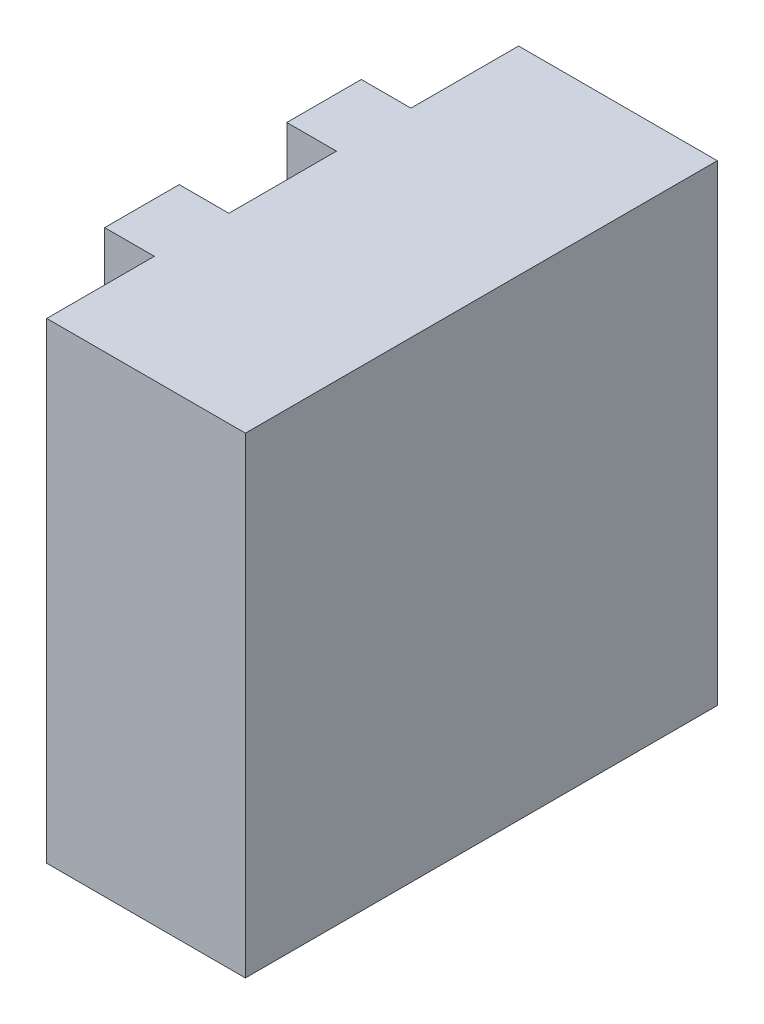
from build123d import *

# Parameters (mm, degrees)
SKETCH_1_W          = 9.5
SKETCH_1_H          = 9.5
EXTRUDE_1_DEPTH     = 4
SKETCH_1_4_W        = 1.5
SKETCH_1_4_H        = 8
EXTRUDE_2_DEPTH     = 1
SKETCH_1_5_W        = 1
SKETCH_1_5_H        = 0.3
SKETCH_1_5_W_2      = 0.3
SKETCH_1_5_H_2      = 1
CUT_EXTRUDE_1_DEPTH = 0.2


with BuildPart() as part:
    # 草图1 → 凸台-拉伸1 (new body)
    with BuildSketch(Plane(origin=(0, 0, 0), x_dir=(0, 0, -1), z_dir=(1, 0, 0))):
        with Locations((4.75, 4.75)):
            Rectangle(SKETCH_1_W, SKETCH_1_H)
    extrude(amount=EXTRUDE_1_DEPTH)

    # 草图1<4> → 凸台-拉伸2 (add)
    with BuildSketch(Plane(origin=(0, 0, 0), x_dir=(0, 0, -1), z_dir=(1, 0, 0))):
        with Locations((6.583333333, 5.5)):
            Rectangle(SKETCH_1_4_W, SKETCH_1_4_H)
        with Locations((2.916666667, 5.5)):
            Rectangle(SKETCH_1_4_W, SKETCH_1_4_H)
    extrude(amount=-EXTRUDE_2_DEPTH)

    # 草图1<5> → 切除-拉伸1 (cut)
    with BuildSketch(Plane(origin=(0, 0, 0), x_dir=(0, 0, -1), z_dir=(1, 0, 0))):
        with Locations((6.583333333, 0.75)):
            Rectangle(SKETCH_1_5_W, SKETCH_1_5_H)
        with Locations((6.583333333, 0.75)):
            Rectangle(SKETCH_1_5_W_2, SKETCH_1_5_H_2)
        with Locations((2.916666667, 0.75)):
            Rectangle(SKETCH_1_5_W, SKETCH_1_5_H)
    extrude(amount=CUT_EXTRUDE_1_DEPTH, mode=Mode.SUBTRACT)


solid = part.part
